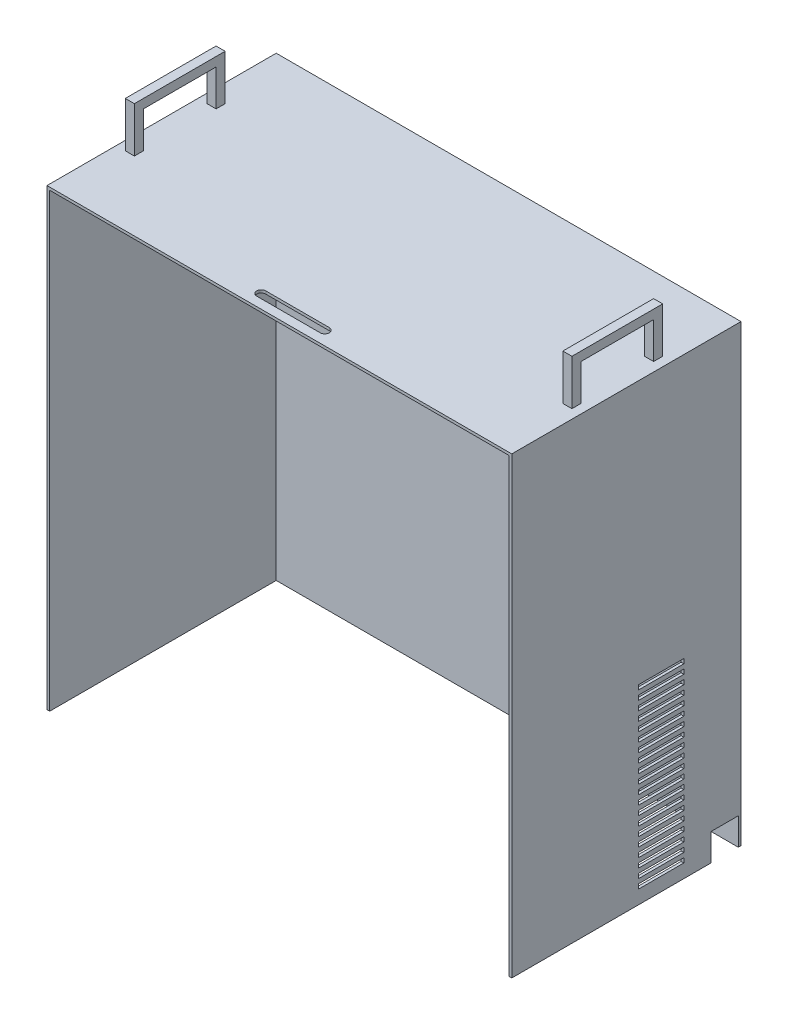
from build123d import *

# Parameters (mm, degrees)
ESBO_O1_W                = 512
ESBO_O1_H                = 505
RESSALTO_EXTRUS_O1_DEPTH = 500
ESBO_O2_W                = 522
ESBO_O2_H                = 510
CORTE_EXTRUS_O1_DEPTH    = 252.5
ESBO_O6_W                = 506
ESBO_O6_H                = 497
CORTE_EXTRUS_O4_DEPTH    = 249.5
ESBO_O7_W                = 30
ESBO_O7_H                = 30
CABO_DE_ALIMENTA_O_DEPTH = 5
ESBO_O9_W                = 50
ESBO_O9_H                = 5
CORTE_EXTRUS_O6_DEPTH    = 5
PASSAGEM_FILAMENTO_DEPTH = 5
ESBO_O69_W               = 10
ESBO_O69_H               = 100
AL_A_2_DEPTH             = 50
ESBO_O70_W               = 80
ESBO_O70_H               = 40
AL_A_2_2_DEPTH           = 10
ESBO_O72_W               = 10
ESBO_O72_H               = 100
AL_A_1_DEPTH             = 50
ESBO_O74_W               = 80
ESBO_O74_H               = 40
AL_A_1_2_DEPTH           = 10


with BuildPart() as part:
    # Esboço1 → Ressalto-extrusão1 (new body)
    with BuildSketch(Plane(origin=(0, 0, 0), x_dir=(1, 0, 0), z_dir=(0, 1, 0))):
        Rectangle(ESBO_O1_W, ESBO_O1_H)
    extrude(amount=RESSALTO_EXTRUS_O1_DEPTH)

    # Esboço2 → Corte-extrusão1 (cut)
    with BuildSketch(Plane.XY.offset(252.5)):
        with Locations((0, 250)):
            Rectangle(ESBO_O2_W, ESBO_O2_H)
    extrude(amount=-CORTE_EXTRUS_O1_DEPTH, mode=Mode.SUBTRACT)

    # Esboço6 → Corte-extrusão4 (cut)
    with BuildSketch(Plane.XY):
        with Locations((0, 248.5)):
            Rectangle(ESBO_O6_W, ESBO_O6_H)
    extrude(amount=-CORTE_EXTRUS_O4_DEPTH, mode=Mode.SUBTRACT)

    # Esboço7 → Cabo de alimentação (cut)
    with BuildSketch(Plane(origin=(256, 0, 0), x_dir=(0, 0, -1), z_dir=(1, 0, 0))):
        with Locations((234.5, 15)):
            Rectangle(ESBO_O7_W, ESBO_O7_H)
    extrude(amount=-CABO_DE_ALIMENTA_O_DEPTH, mode=Mode.SUBTRACT)

    # Esboço9 → Corte-extrusão6 (cut)
    with BuildSketch(Plane(origin=(256, 0, 0), x_dir=(0, 0, -1), z_dir=(1, 0, 0))):
        with Locations((164.5, 17.5)):
            Rectangle(ESBO_O9_W, ESBO_O9_H)
        with Locations((164.5, 27.5)):
            Rectangle(ESBO_O9_W, ESBO_O9_H)
        with Locations((164.5, 47.5)):
            Rectangle(ESBO_O9_W, ESBO_O9_H)
        with Locations((164.5, 37.5)):
            Rectangle(ESBO_O9_W, ESBO_O9_H)
        with Locations((164.5, 67.5)):
            Rectangle(ESBO_O9_W, ESBO_O9_H)
        with Locations((164.5, 77.5)):
            Rectangle(ESBO_O9_W, ESBO_O9_H)
        with Locations((164.5, 87.5)):
            Rectangle(ESBO_O9_W, ESBO_O9_H)
        with Locations((164.5, 57.5)):
            Rectangle(ESBO_O9_W, ESBO_O9_H)
        with Locations((164.5, 107.5)):
            Rectangle(ESBO_O9_W, ESBO_O9_H)
        with Locations((164.5, 157.5)):
            Rectangle(ESBO_O9_W, ESBO_O9_H)
        with Locations((164.5, 117.5)):
            Rectangle(ESBO_O9_W, ESBO_O9_H)
        with Locations((164.5, 167.5)):
            Rectangle(ESBO_O9_W, ESBO_O9_H)
        with Locations((164.5, 127.5)):
            Rectangle(ESBO_O9_W, ESBO_O9_H)
        with Locations((164.5, 97.5)):
            Rectangle(ESBO_O9_W, ESBO_O9_H)
        with Locations((164.5, 147.5)):
            Rectangle(ESBO_O9_W, ESBO_O9_H)
        with Locations((164.5, 137.5)):
            Rectangle(ESBO_O9_W, ESBO_O9_H)
        with Locations((164.5, 177.5)):
            Rectangle(ESBO_O9_W, ESBO_O9_H)
        with Locations((164.5, 187.5)):
            Rectangle(ESBO_O9_W, ESBO_O9_H)
        with Locations((164.5, 207.5)):
            Rectangle(ESBO_O9_W, ESBO_O9_H)
        with Locations((164.5, 197.5)):
            Rectangle(ESBO_O9_W, ESBO_O9_H)
    extrude(amount=-CORTE_EXTRUS_O6_DEPTH, mode=Mode.SUBTRACT)

    # Esboço68 → Passagem Filamento (cut)
    with BuildSketch(Plane(origin=(0, 500, 0), x_dir=(1, 0, 0), z_dir=(0, 1, 0))):
        with BuildLine():
            Line((-35, 20), (35, 20))
            ThreePointArc((35, 20), (40, 15), (35, 10))
            Line((35, 10), (-35, 10))
            ThreePointArc((-35, 10), (-40, 15), (-35, 20))
        make_face()
    extrude(amount=-PASSAGEM_FILAMENTO_DEPTH, mode=Mode.SUBTRACT)

    # Esboço69 → Al_a - 2 (add)
    with BuildSketch(Plane(origin=(0, 500, 0), x_dir=(1, 0, 0), z_dir=(0, 1, 0))):
        with Locations((-241, 126.25)):
            Rectangle(ESBO_O69_W, ESBO_O69_H)
    extrude(amount=AL_A_2_DEPTH)

    # Esboço70 → Al_a _2 2 (cut)
    with BuildSketch(Plane.ZY.offset(246)):
        with Locations((-126.25, 520)):
            Rectangle(ESBO_O70_W, ESBO_O70_H)
    extrude(amount=-AL_A_2_2_DEPTH, mode=Mode.SUBTRACT)

    # Esboço72 → Al_a - 1 (add)
    with BuildSketch(Plane(origin=(531.113648875, 500, -10.670910915), x_dir=(1, 0, 0), z_dir=(0, 1, 0))):
        with Locations((-290.113648875, 115.579089085)):
            Rectangle(ESBO_O72_W, ESBO_O72_H)
    extrude(amount=AL_A_1_DEPTH)

    # Esboço74 → Al_a _1 2 (cut)
    with BuildSketch(Plane(origin=(236, 0, -10.670910915), x_dir=(0, 0, 1), z_dir=(-1, 0, 0))):
        with Locations((-115.579089085, 520)):
            Rectangle(ESBO_O74_W, ESBO_O74_H)
    extrude(amount=-AL_A_1_2_DEPTH, mode=Mode.SUBTRACT)


solid = part.part
